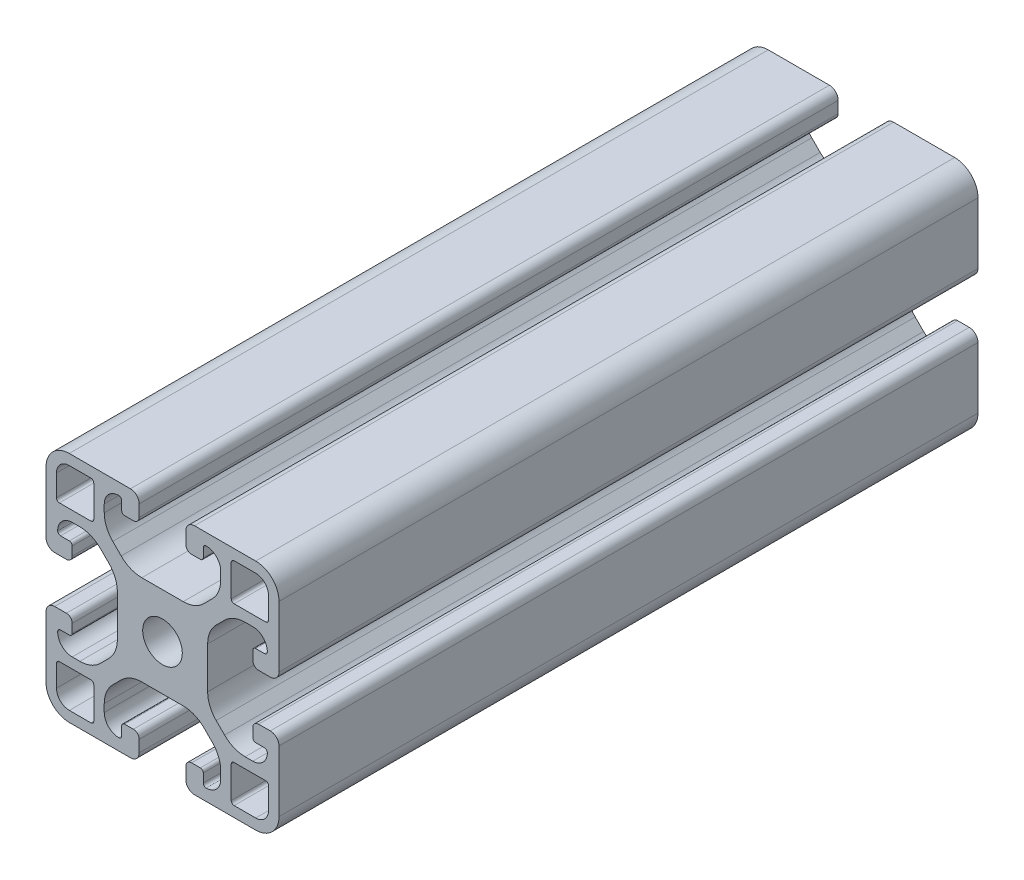
from build123d import *

# Parameters (mm, degrees)
ESQUISSE1_R        = 3.4
BOSS_EXTRU_1_DEPTH = 120


with BuildPart() as part:
    # Esquisse1 → Boss.-Extru.1 (new body)
    with BuildSketch(Plane(origin=(0, 0, -30), x_dir=(-1, 0, 0), z_dir=(0, 0, -1))):
        with BuildLine():
            Line((-4.5, 15), (-4.5, 13.5))
            ThreePointArc((-4.5, 13.5), (-4.353553391, 13.146446609), (-4, 13))
            Line((-4, 13), (-2.5, 13))
            ThreePointArc((-2.5, 13), (-2.146446609, 12.853553391), (-2, 12.5))
            ThreePointArc((-2, 12.5), (-2.732233047, 10.732233047), (-4.5, 10))
            Line((-4.5, 10), (-5.807611845, 10))
            ThreePointArc((-5.807611845, 10), (-7.721029006, 10.380602337), (-9.343145751, 11.464466094))
            Line((-9.343145751, 11.464466094), (-10.785533906, 12.906854249))
            ThreePointArc((-10.785533906, 12.906854249), (-11.869397663, 14.528970994), (-12.25, 16.442388155))
            Line((-12.25, 16.442388155), (-12.25, 23.557611845))
            ThreePointArc((-12.25, 23.557611845), (-11.869397663, 25.471029006), (-10.785533906, 27.093145751))
            Line((-10.785533906, 27.093145751), (-9.343145751, 28.535533906))
            ThreePointArc((-9.343145751, 28.535533906), (-7.721029006, 29.619397663), (-5.807611845, 30))
            Line((-5.807611845, 30), (-4.5, 30))
            ThreePointArc((-4.5, 30), (-2.732233047, 29.267766953), (-2, 27.5))
            ThreePointArc((-2, 27.5), (-2.146446609, 27.146446609), (-2.5, 27))
            Line((-2.5, 27), (-4, 27))
            ThreePointArc((-4, 27), (-4.353553391, 26.853553391), (-4.5, 26.5))
            Line((-4.5, 26.5), (-4.5, 25))
            ThreePointArc((-4.5, 25), (-4.207106781, 24.292893219), (-3.5, 24))
            Line((-3.5, 24), (-1.5, 24))
            ThreePointArc((-1.5, 24), (-0.439339828, 24.439339828), (0, 25.5))
            Line((0, 25.5), (0, 36))
            ThreePointArc((0, 36), (-1.171572875, 38.828427125), (-4, 40))
            Line((-4, 40), (-14.5, 40))
            ThreePointArc((-14.5, 40), (-15.560660172, 39.560660172), (-16, 38.5))
            Line((-16, 38.5), (-16, 36.5))
            ThreePointArc((-16, 36.5), (-15.707106781, 35.792893219), (-15, 35.5))
            Line((-15, 35.5), (-13.5, 35.5))
            ThreePointArc((-13.5, 35.5), (-13.146446609, 35.646446609), (-13, 36))
            Line((-13, 36), (-13, 37.5))
            ThreePointArc((-13, 37.5), (-12.853553391, 37.853553391), (-12.5, 38))
            ThreePointArc((-12.5, 38), (-10.732233047, 37.267766953), (-10, 35.5))
            Line((-10, 35.5), (-10, 34.192388155))
            ThreePointArc((-10, 34.192388155), (-10.380602337, 32.278970994), (-11.464466094, 30.656854249))
            Line((-11.464466094, 30.656854249), (-12.906854249, 29.214466094))
            ThreePointArc((-12.906854249, 29.214466094), (-14.528970994, 28.130602337), (-16.442388155, 27.75))
            Line((-16.442388155, 27.75), (-23.557611845, 27.75))
            ThreePointArc((-23.557611845, 27.75), (-25.471029006, 28.130602337), (-27.093145751, 29.214466094))
            Line((-27.093145751, 29.214466094), (-28.535533906, 30.656854249))
            ThreePointArc((-28.535533906, 30.656854249), (-29.619397663, 32.278970994), (-30, 34.192388155))
            Line((-30, 34.192388155), (-30, 35.5))
            ThreePointArc((-30, 35.5), (-29.267766953, 37.267766953), (-27.5, 38))
            ThreePointArc((-27.5, 38), (-27.146446609, 37.853553391), (-27, 37.5))
            Line((-27, 37.5), (-27, 36))
            ThreePointArc((-27, 36), (-26.853553391, 35.646446609), (-26.5, 35.5))
            Line((-26.5, 35.5), (-25, 35.5))
            ThreePointArc((-25, 35.5), (-24.292893219, 35.792893219), (-24, 36.5))
            Line((-24, 36.5), (-24, 38.5))
            ThreePointArc((-24, 38.5), (-24.439339828, 39.560660172), (-25.5, 40))
            Line((-25.5, 40), (-36, 40))
            ThreePointArc((-36, 40), (-38.828427125, 38.828427125), (-40, 36))
            Line((-40, 36), (-40, 25.5))
            ThreePointArc((-40, 25.5), (-39.560660172, 24.439339828), (-38.5, 24))
            Line((-38.5, 24), (-36.5, 24))
            ThreePointArc((-36.5, 24), (-35.792893219, 24.292893219), (-35.5, 25))
            Line((-35.5, 25), (-35.5, 26.5))
            ThreePointArc((-35.5, 26.5), (-35.646446609, 26.853553391), (-36, 27))
            Line((-36, 27), (-37.5, 27))
            ThreePointArc((-37.5, 27), (-37.853553391, 27.146446609), (-38, 27.5))
            ThreePointArc((-38, 27.5), (-37.267766953, 29.267766953), (-35.5, 30))
            Line((-35.5, 30), (-34.192388155, 30))
            ThreePointArc((-34.192388155, 30), (-32.278970994, 29.619397663), (-30.656854249, 28.535533906))
            Line((-30.656854249, 28.535533906), (-29.214466094, 27.093145751))
            ThreePointArc((-29.214466094, 27.093145751), (-28.130602337, 25.471029006), (-27.75, 23.557611845))
            Line((-27.75, 23.557611845), (-27.75, 16.442388155))
            ThreePointArc((-27.75, 16.442388155), (-28.130602337, 14.528970994), (-29.214466094, 12.906854249))
            Line((-29.214466094, 12.906854249), (-30.656854249, 11.464466094))
            ThreePointArc((-30.656854249, 11.464466094), (-32.278970994, 10.380602337), (-34.192388155, 10))
            Line((-34.192388155, 10), (-35.5, 10))
            ThreePointArc((-35.5, 10), (-37.267766953, 10.732233047), (-38, 12.5))
            ThreePointArc((-38, 12.5), (-37.853553391, 12.853553391), (-37.5, 13))
            Line((-37.5, 13), (-36, 13))
            ThreePointArc((-36, 13), (-35.646446609, 13.146446609), (-35.5, 13.5))
            Line((-35.5, 13.5), (-35.5, 15))
            ThreePointArc((-35.5, 15), (-35.792893219, 15.707106781), (-36.5, 16))
            Line((-36.5, 16), (-38.5, 16))
            ThreePointArc((-38.5, 16), (-39.560660172, 15.560660172), (-40, 14.5))
            Line((-40, 14.5), (-40, 4))
            ThreePointArc((-40, 4), (-38.828427125, 1.171572875), (-36, 0))
            Line((-36, 0), (-25.5, 0))
            ThreePointArc((-25.5, 0), (-24.439339828, 0.439339828), (-24, 1.5))
            Line((-24, 1.5), (-24, 3.5))
            ThreePointArc((-24, 3.5), (-24.292893219, 4.207106781), (-25, 4.5))
            Line((-25, 4.5), (-26.5, 4.5))
            ThreePointArc((-26.5, 4.5), (-26.853553391, 4.353553391), (-27, 4))
            Line((-27, 4), (-27, 2.5))
            ThreePointArc((-27, 2.5), (-27.146446609, 2.146446609), (-27.5, 2))
            ThreePointArc((-27.5, 2), (-29.267766953, 2.732233047), (-30, 4.5))
            Line((-30, 4.5), (-30, 5.807611845))
            ThreePointArc((-30, 5.807611845), (-29.619397663, 7.721029006), (-28.535533906, 9.343145751))
            Line((-28.535533906, 9.343145751), (-27.093145751, 10.785533906))
            ThreePointArc((-27.093145751, 10.785533906), (-25.471029006, 11.869397663), (-23.557611845, 12.25))
            Line((-23.557611845, 12.25), (-16.442388155, 12.25))
            ThreePointArc((-16.442388155, 12.25), (-14.528970994, 11.869397663), (-12.906854249, 10.785533906))
            Line((-12.906854249, 10.785533906), (-11.464466094, 9.343145751))
            ThreePointArc((-11.464466094, 9.343145751), (-10.380602337, 7.721029006), (-10, 5.807611845))
            Line((-10, 5.807611845), (-10, 4.5))
            ThreePointArc((-10, 4.5), (-10.732233047, 2.732233047), (-12.5, 2))
            ThreePointArc((-12.5, 2), (-12.853553391, 2.146446609), (-13, 2.5))
            Line((-13, 2.5), (-13, 4))
            ThreePointArc((-13, 4), (-13.146446609, 4.353553391), (-13.5, 4.5))
            Line((-13.5, 4.5), (-15, 4.5))
            ThreePointArc((-15, 4.5), (-15.707106781, 4.207106781), (-16, 3.5))
            Line((-16, 3.5), (-16, 1.5))
            ThreePointArc((-16, 1.5), (-15.560660172, 0.439339828), (-14.5, 0))
            Line((-14.5, 0), (-4, 0))
            ThreePointArc((-4, 0), (-1.171572875, 1.171572875), (0, 4))
            Line((0, 4), (0, 14.5))
            ThreePointArc((0, 14.5), (-0.439339828, 15.560660172), (-1.5, 16))
            Line((-1.5, 16), (-3.5, 16))
            ThreePointArc((-3.5, 16), (-4.207106781, 15.707106781), (-4.5, 15))
        make_face()
        with Locations(Location((-20, 20, 0), (0, 0, 180))):
            Circle(ESQUISSE1_R, mode=Mode.SUBTRACT)
        with BuildLine():
            Line((-4, 1.8), (-7.7, 1.8))
            ThreePointArc((-7.7, 1.8), (-8.053553391, 1.946446609), (-8.2, 2.3))
            Line((-8.2, 2.3), (-8.2, 7.7))
            ThreePointArc((-8.2, 7.7), (-8.053553391, 8.053553391), (-7.7, 8.2))
            Line((-7.7, 8.2), (-2.3, 8.2))
            ThreePointArc((-2.3, 8.2), (-1.946446609, 8.053553391), (-1.8, 7.7))
            Line((-1.8, 7.7), (-1.8, 4))
            ThreePointArc((-1.8, 4), (-2.444365081, 2.444365081), (-4, 1.8))
        make_face(mode=Mode.SUBTRACT)
        with BuildLine():
            Line((-38.2, 4), (-38.2, 7.7))
            ThreePointArc((-38.2, 7.7), (-38.053553391, 8.053553391), (-37.7, 8.2))
            Line((-37.7, 8.2), (-32.3, 8.2))
            ThreePointArc((-32.3, 8.2), (-31.946446609, 8.053553391), (-31.8, 7.7))
            Line((-31.8, 7.7), (-31.8, 2.3))
            ThreePointArc((-31.8, 2.3), (-31.946446609, 1.946446609), (-32.3, 1.8))
            Line((-32.3, 1.8), (-36, 1.8))
            ThreePointArc((-36, 1.8), (-37.555634919, 2.444365081), (-38.2, 4))
        make_face(mode=Mode.SUBTRACT)
        with BuildLine():
            Line((-36, 38.2), (-32.3, 38.2))
            ThreePointArc((-32.3, 38.2), (-31.946446609, 38.053553391), (-31.8, 37.7))
            Line((-31.8, 37.7), (-31.8, 32.3))
            ThreePointArc((-31.8, 32.3), (-31.946446609, 31.946446609), (-32.3, 31.8))
            Line((-32.3, 31.8), (-37.7, 31.8))
            ThreePointArc((-37.7, 31.8), (-38.053553391, 31.946446609), (-38.2, 32.3))
            Line((-38.2, 32.3), (-38.2, 36))
            ThreePointArc((-38.2, 36), (-37.555634919, 37.555634919), (-36, 38.2))
        make_face(mode=Mode.SUBTRACT)
        with BuildLine():
            Line((-1.8, 36), (-1.8, 32.3))
            ThreePointArc((-1.8, 32.3), (-1.946446609, 31.946446609), (-2.3, 31.8))
            Line((-2.3, 31.8), (-7.7, 31.8))
            ThreePointArc((-7.7, 31.8), (-8.053553391, 31.946446609), (-8.2, 32.3))
            Line((-8.2, 32.3), (-8.2, 37.7))
            ThreePointArc((-8.2, 37.7), (-8.053553391, 38.053553391), (-7.7, 38.2))
            Line((-7.7, 38.2), (-4, 38.2))
            ThreePointArc((-4, 38.2), (-2.444365081, 37.555634919), (-1.8, 36))
        make_face(mode=Mode.SUBTRACT)
    extrude(amount=-BOSS_EXTRU_1_DEPTH)


solid = part.part
